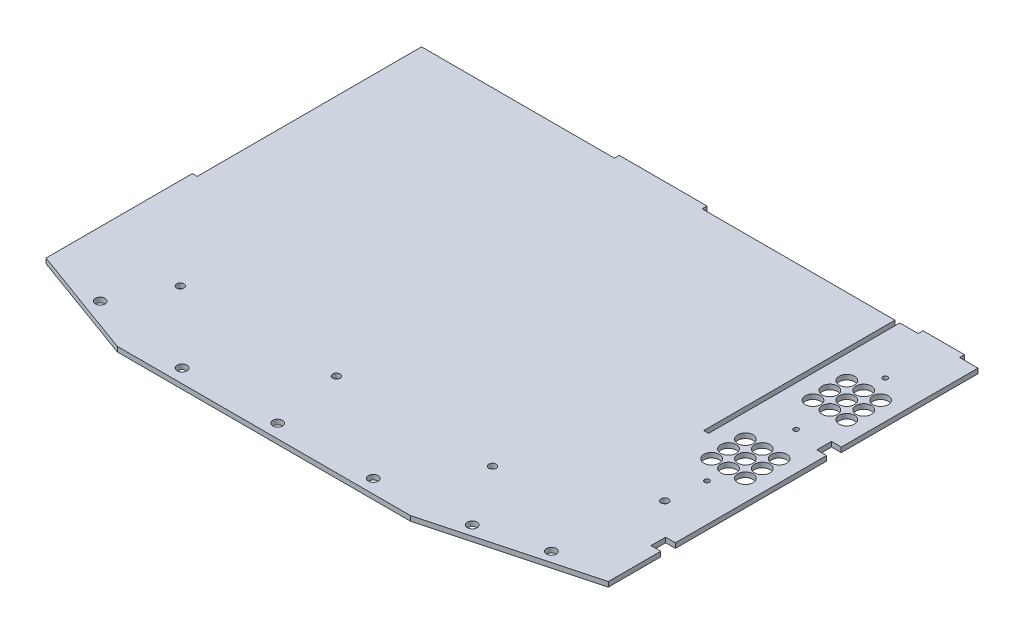
from build123d import *

# Parameters (mm, degrees)
SKETCH1_W            = 308.08168
SKETCH1_H            = 3.175
BOSS_EXTRUDE1_DEPTH  = 267.83
SKETCH3_W            = 267.83
SKETCH3_H            = 3.175
BOSS_EXTRUDE3_DEPTH  = 3.175
SKETCH4_W            = 50.8889
SKETCH4_H            = 3.175
BOSS_EXTRUDE4_DEPTH  = 267.83
CUT_EXTRUDE1_DEPTH   = 340.191055801
SKETCH17_W           = 267.83
SKETCH17_H           = 3.175
BOSS_EXTRUDE5_DEPTH  = 3.175
CUT_EXTRUDE3_DEPTH   = 340.191055801
SKETCH25_R           = 3.175
CUT_EXTRUDE8_DEPTH   = 3.175
SKETCH27_R           = 5
CUT_EXTRUDE9_DEPTH   = 340.191055801
SKETCH31_R           = 1.5875
CUT_EXTRUDE10_DEPTH  = 340.191055801
LPATTERN1_COUNT      = 3
LPATTERN1_PITCH      = 58
M4_CLEARANCE_HOLE1_D = 4.8
SKETCH36_W           = 57.15
SKETCH36_H           = 3.175
SKETCH36_W_2         = 26.9875
BOSS_EXTRUDE6_DEPTH  = 3.175
SKETCH37_W           = 3.175
SKETCH37_H           = 124.4419914
CUT_EXTRUDE11_DEPTH  = 340.191055801
SKETCH38_W           = 3.175
SKETCH38_H           = 146.0243
CUT_EXTRUDE12_DEPTH  = 340.191055801
SKETCH39_W           = 6.35
SKETCH39_H           = 9.525
CUT_EXTRUDE13_DEPTH  = 340.191055801


with BuildPart() as part:
    # Sketch1 → Boss-Extrude1 (new body)
    with BuildSketch(Plane.XY):
        Rectangle(SKETCH1_W, SKETCH1_H)
    extrude(amount=BOSS_EXTRUDE1_DEPTH)

    # Sketch3 → Boss-Extrude3 (add)
    with BuildSketch(Plane(origin=(154.04084, 0, 0), x_dir=(0, 0, -1), z_dir=(1, 0, 0))):
        with Locations((-133.915, 0)):
            Rectangle(SKETCH3_W, SKETCH3_H)
    extrude(amount=BOSS_EXTRUDE3_DEPTH)

    # Sketch4 → Boss-Extrude4 (add)
    with BuildSketch(Plane.XY.offset(267.83)):
        with Locations((182.66029, 0)):
            Rectangle(SKETCH4_W, SKETCH4_H)
    extrude(amount=-BOSS_EXTRUDE4_DEPTH)

    # Sketch6 → Cut-Extrude1 (cut, through all)
    with BuildSketch(Plane(origin=(0, 1.5875, 0), x_dir=(1, 0, 0), z_dir=(0, 1, 0))):
        Polygon((208.10474, -240.606362049), (106.50474, -267.83), (208.10474, -267.83), align=None)
    extrude(amount=-CUT_EXTRUDE1_DEPTH, mode=Mode.SUBTRACT)

    # Sketch17 → Boss-Extrude5 (add)
    with BuildSketch(Plane.ZY.offset(154.04084)):
        with Locations((133.915, 0)):
            Rectangle(SKETCH17_W, SKETCH17_H)
    extrude(amount=BOSS_EXTRUDE5_DEPTH)

    # Sketch11 → Cut-Extrude3 (cut, through all)
    with BuildSketch(Plane.XZ.offset(1.5875)):
        Polygon((-157.21584, 241.2743), (-84.254653892, 267.83), (-157.21584, 267.83), align=None)
    extrude(amount=-CUT_EXTRUDE3_DEPTH, mode=Mode.SUBTRACT)

    # Sketch25 → Cut-Extrude8 (cut)
    with BuildSketch(Plane.XZ.offset(1.5875)):
        with Locations(Location((-115.322188641, 247.921359373, 0), (0, 0, 270))):
            Circle(SKETCH25_R)
        with Locations(Location((-50.97526, 258.94, 0), (0, 0, 270))):
            Circle(SKETCH25_R)
        with Locations(Location((11.25474, 258.94, 0), (0, 0, 270))):
            Circle(SKETCH25_R)
        with Locations(Location((73.48474, 258.94, 0), (0, 0, 270))):
            Circle(SKETCH25_R)
        with Locations(Location((172.54474, 242.09298883, 0), (0, 0, 270))):
            Circle(SKETCH25_R)
        with Locations(Location((131.90474, 252.982444011, 0), (0, 0, 270))):
            Circle(SKETCH25_R)
    extrude(amount=-CUT_EXTRUDE8_DEPTH, mode=Mode.SUBTRACT)

    # Sketch27 → Cut-Extrude9 (cut, through all)
    with BuildSketch(Plane.XZ.offset(1.5875)):
        with Locations(Location((172.48674, 137.774823778, 0), (0, 0, 270))):
            Circle(SKETCH27_R)
        with Locations(Location((183.48674, 137.774823778, 0), (0, 0, 270))):
            Circle(SKETCH27_R)
        with Locations(Location((194.48674, 137.774823778, 0), (0, 0, 270))):
            Circle(SKETCH27_R)
        with Locations(Location((194.48674, 126.774823778, 0), (0, 0, 270))):
            Circle(SKETCH27_R)
        with Locations(Location((194.48674, 115.774823778, 0), (0, 0, 270))):
            Circle(SKETCH27_R)
        with Locations(Location((183.48674, 126.774823778, 0), (0, 0, 270))):
            Circle(SKETCH27_R)
        with Locations(Location((183.48674, 115.774823778, 0), (0, 0, 270))):
            Circle(SKETCH27_R)
        with Locations(Location((172.48674, 115.774823778, 0), (0, 0, 270))):
            Circle(SKETCH27_R)
        with Locations(Location((172.48674, 126.774823778, 0), (0, 0, 270))):
            Circle(SKETCH27_R)
        with Locations(Location((194.48674, 71.774823778, 0), (0, 0, 270))):
            Circle(SKETCH27_R)
        with Locations(Location((194.48674, 60.774823778, 0), (0, 0, 270))):
            Circle(SKETCH27_R)
        with Locations(Location((194.48674, 49.774823778, 0), (0, 0, 270))):
            Circle(SKETCH27_R)
        with Locations(Location((183.48674, 71.774823778, 0), (0, 0, 270))):
            Circle(SKETCH27_R)
        with Locations(Location((183.48674, 60.774823778, 0), (0, 0, 270))):
            Circle(SKETCH27_R)
        with Locations(Location((183.48674, 49.774823778, 0), (0, 0, 270))):
            Circle(SKETCH27_R)
        with Locations(Location((172.48674, 49.774823778, 0), (0, 0, 270))):
            Circle(SKETCH27_R)
        with Locations(Location((172.48674, 60.774823778, 0), (0, 0, 270))):
            Circle(SKETCH27_R)
        with Locations(Location((172.48674, 71.774823778, 0), (0, 0, 270))):
            Circle(SKETCH27_R)
    extrude(amount=-CUT_EXTRUDE9_DEPTH, mode=Mode.SUBTRACT)

    # Sketch31 → Cut-Extrude10 (cut, symmetric)
    with BuildSketch(Plane.XZ.offset(1.5875)):
        with Locations(Location((183.48674, 151.774823778, 0), (0, 0, 270))):
            Circle(SKETCH31_R)
    cut_extrude10 = extrude(amount=CUT_EXTRUDE10_DEPTH, both=True, mode=Mode.SUBTRACT)

    # LPattern1: Cut-Extrude10 ×3
    with Locations(*[(0, 0, -i * LPATTERN1_PITCH) for i in range(1, LPATTERN1_COUNT)]):
        add(cut_extrude10, mode=Mode.SUBTRACT)

    # M4 Clearance Hole1 (through all)
    with Locations(Plane.XZ.offset(1.5875)):
        with Locations((180.96500002, 176.776), (-97.77095, 213.2849914), (3.82905, 213.2849914), (105.42905, 213.2849914)):
            Hole(M4_CLEARANCE_HOLE1_D / 2)

    # Sketch36 → Boss-Extrude6 (add)
    with BuildSketch(Plane(origin=(0, 0, 0), x_dir=(-1, 0, 0), z_dir=(0, 0, -1))):
        Rectangle(SKETCH36_W, SKETCH36_H)
        with Locations((-182.66100002, 0)):
            Rectangle(SKETCH36_W_2, SKETCH36_H)
    extrude(amount=BOSS_EXTRUDE6_DEPTH)

    # Sketch37 → Cut-Extrude11 (cut, through all)
    with BuildSketch(Plane.XZ.offset(1.5875)):
        with Locations((155.62850002, 62.2209957)):
            Rectangle(SKETCH37_W, SKETCH37_H)
    extrude(amount=-CUT_EXTRUDE11_DEPTH, mode=Mode.SUBTRACT)

    # Sketch38 → Cut-Extrude12 (cut, through all)
    with BuildSketch(Plane.XZ.offset(1.5875)):
        with Locations((-155.62834, 73.01215)):
            Rectangle(SKETCH38_W, SKETCH38_H)
    extrude(amount=-CUT_EXTRUDE12_DEPTH, mode=Mode.SUBTRACT)

    # Sketch39 → Cut-Extrude13 (cut, through all)
    with BuildSketch(Plane.XZ.offset(1.5875)):
        with Locations((204.92974, 93.774823778)):
            Rectangle(SKETCH39_W, SKETCH39_H)
        with Locations((204.92974, 201.724823778)):
            Rectangle(SKETCH39_W, SKETCH39_H)
    extrude(amount=-CUT_EXTRUDE13_DEPTH, mode=Mode.SUBTRACT)


solid = part.part
